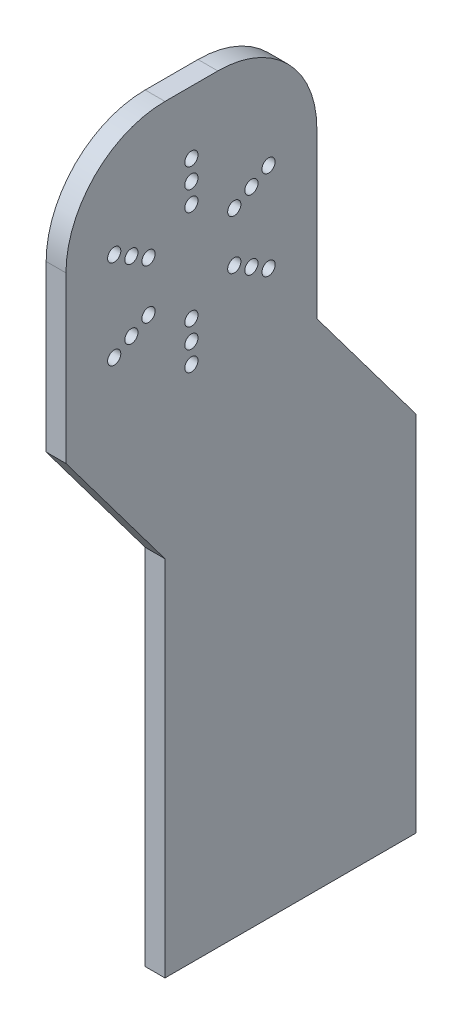
from build123d import *

# Parameters (mm, degrees)
SKETCH1_W           = 31
SKETCH1_H           = 55
SKETCH1_R           = 1
SKETCH1_W_2         = 22
SKETCH1_H_2         = 44
BOSS_EXTRUDE1_DEPTH = 3
SKETCH2_W           = 3
SKETCH2_H           = 55
BOSS_EXTRUDE2_DEPTH = 35
SKETCH3_W           = 3
SKETCH3_H           = 53
BOSS_EXTRUDE3_DEPTH = 20
CUT_EXTRUDE1_DEPTH  = 3
SKETCH5_W           = 3
SKETCH5_H           = 38
BOSS_EXTRUDE4_DEPTH = 40
SKETCH6_R           = 1
CUT_EXTRUDE2_DEPTH  = 31
FILLET1_R           = 15


with BuildPart() as part:
    # Sketch1 → Boss-Extrude1 (new body)
    with BuildSketch(Plane.XY):
        with Locations((1.5, 0)):
            Rectangle(SKETCH1_W, SKETCH1_H)
        with Locations((-4.85, -24)):
            Circle(SKETCH1_R, mode=Mode.SUBTRACT)
        with Locations((4.85, -24)):
            Circle(SKETCH1_R, mode=Mode.SUBTRACT)
        with Locations((4.85, 24)):
            Circle(SKETCH1_R, mode=Mode.SUBTRACT)
        with Locations((-4.85, 24)):
            Circle(SKETCH1_R, mode=Mode.SUBTRACT)
        Rectangle(SKETCH1_W_2, SKETCH1_H_2, mode=Mode.SUBTRACT)
    extrude(amount=BOSS_EXTRUDE1_DEPTH)

    # Sketch2 → Boss-Extrude2 (add)
    with BuildSketch(Plane.XY.offset(3)):
        with Locations((15.5, 0)):
            Rectangle(SKETCH2_W, SKETCH2_H)
    extrude(amount=BOSS_EXTRUDE2_DEPTH)

    # Sketch3 → Boss-Extrude3 (add)
    with BuildSketch(Plane(origin=(0, 27.5, 0), x_dir=(1, 0, 0), z_dir=(0, 1, 0))):
        with Locations((15.5, -26.5)):
            Rectangle(SKETCH3_W, SKETCH3_H)
    extrude(amount=BOSS_EXTRUDE3_DEPTH)

    # Sketch4 → Cut-Extrude1 (cut)
    with BuildSketch(Plane.ZY.offset(-14)):
        Polygon((53, 27.5), (38, 27.5), (53, 47.5), align=None)
        Polygon((0, 27.5), (0, 47.5), (15, 47.5), align=None)
    extrude(amount=-CUT_EXTRUDE1_DEPTH, mode=Mode.SUBTRACT)

    # Sketch5 → Boss-Extrude4 (add)
    with BuildSketch(Plane(origin=(0, 47.5, 0), x_dir=(1, 0, 0), z_dir=(0, 1, 0))):
        with Locations((15.5, -34)):
            Rectangle(SKETCH5_W, SKETCH5_H)
    extrude(amount=BOSS_EXTRUDE4_DEPTH)

    # Sketch6 → Cut-Extrude2 (cut)
    with BuildSketch(Plane.ZY.offset(14)):
        with Locations((34, 72)):
            Circle(SKETCH6_R)
        with Locations((34, 75)):
            Circle(SKETCH6_R)
        with Locations((34, 78)):
            Circle(SKETCH6_R)
        with Locations((45.691342951, 71.25)):
            Circle(SKETCH6_R)
        with Locations((43.09326674, 69.75)):
            Circle(SKETCH6_R)
        with Locations((40.495190528, 68.25)):
            Circle(SKETCH6_R)
        with Locations((45.691342951, 57.75)):
            Circle(SKETCH6_R)
        with Locations((43.09326674, 59.25)):
            Circle(SKETCH6_R)
        with Locations((40.495190528, 60.75)):
            Circle(SKETCH6_R)
        with Locations((34, 51)):
            Circle(SKETCH6_R)
        with Locations((34, 54)):
            Circle(SKETCH6_R)
        with Locations((34, 57)):
            Circle(SKETCH6_R)
        with Locations((22.308657049, 57.75)):
            Circle(SKETCH6_R)
        with Locations((24.90673326, 59.25)):
            Circle(SKETCH6_R)
        with Locations((27.504809472, 60.75)):
            Circle(SKETCH6_R)
        with Locations((22.308657049, 71.25)):
            Circle(SKETCH6_R)
        with Locations((24.90673326, 69.75)):
            Circle(SKETCH6_R)
        with Locations((27.504809472, 68.25)):
            Circle(SKETCH6_R)
    extrude(amount=-CUT_EXTRUDE2_DEPTH, mode=Mode.SUBTRACT)

    # Fillet1
    fillet1_edges = [part.edges().sort_by_distance(p)[0] for p in [
        (15.5, 87.5, 53),
        (15.5, 87.5, 15),
    ]]
    fillet(fillet1_edges, radius=FILLET1_R)


solid = part.part
